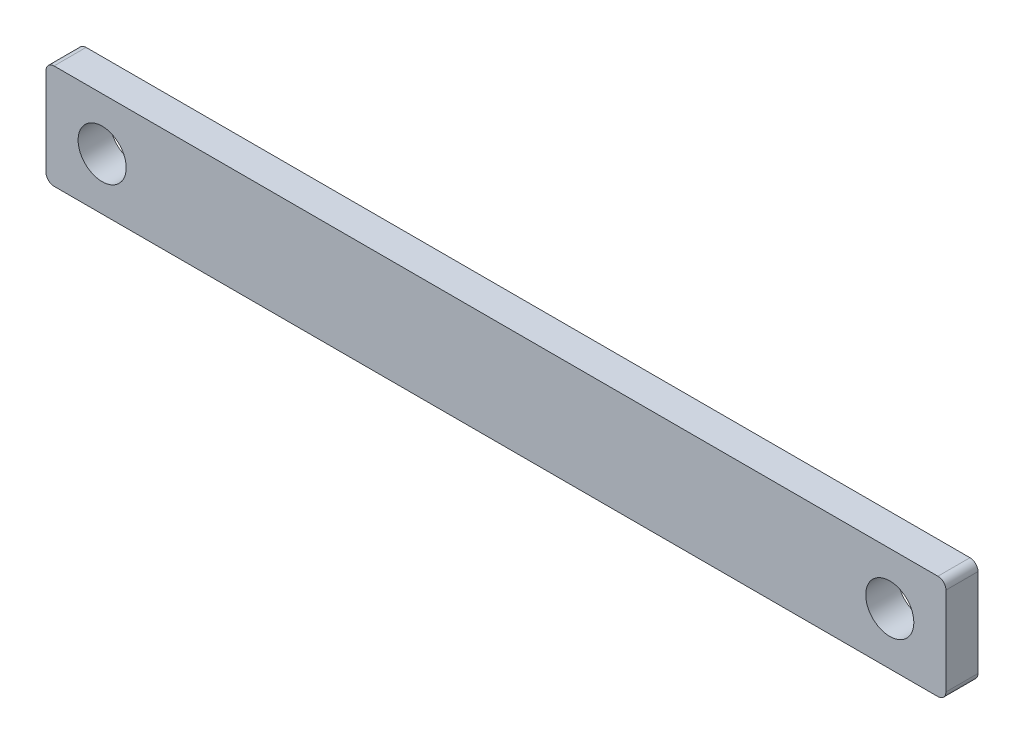
from build123d import *

# Parameters (mm, degrees)
IZIM1_R                     = 30
Y_KSEKLIK_EKSTR_ZYON1_DEPTH = 40


with BuildPart() as part:
    # Çizim1 → Yükseklik-Ekstrüzyon1 (new body)
    with BuildSketch(Plane.XY):
        with BuildLine():
            Line((10, 0), (1112, 0))
            ThreePointArc((1112, 0), (1119.071067812, 2.928932188), (1122, 10))
            Line((1122, 10), (1122, 120))
            ThreePointArc((1122, 120), (1119.071067812, 127.071067812), (1112, 130))
            Line((1112, 130), (10, 130))
            ThreePointArc((10, 130), (2.928932188, 127.071067812), (0, 120))
            Line((0, 120), (0, 10))
            ThreePointArc((0, 10), (2.928932188, 2.928932188), (10, 0))
        make_face()
        with Locations((70, 65)):
            Circle(IZIM1_R, mode=Mode.SUBTRACT)
        with Locations((1052, 65)):
            Circle(IZIM1_R, mode=Mode.SUBTRACT)
    extrude(amount=Y_KSEKLIK_EKSTR_ZYON1_DEPTH)


solid = part.part
